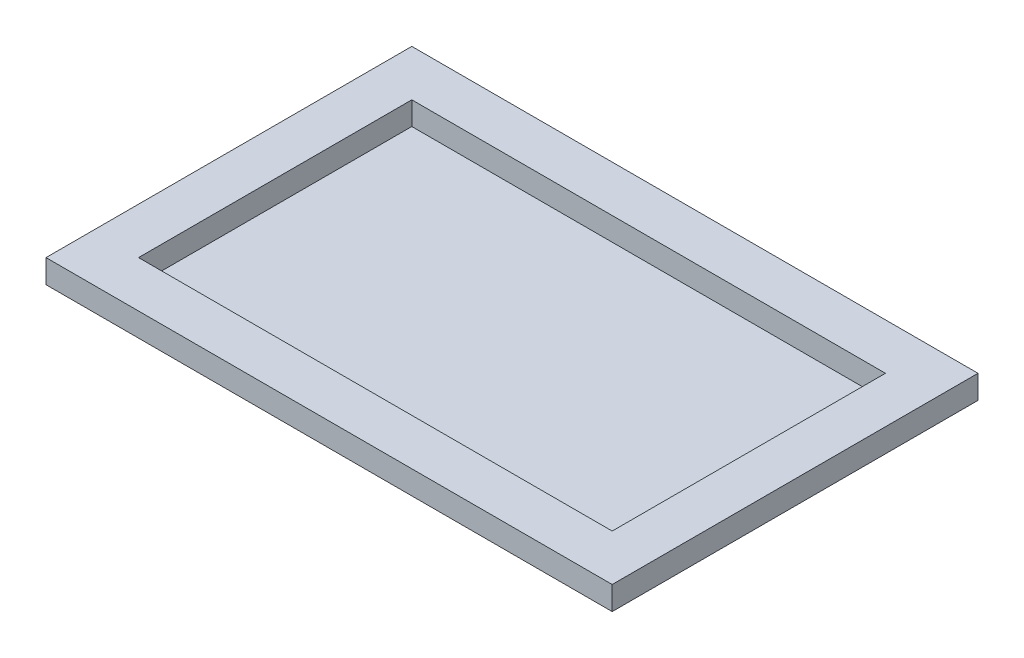
from build123d import *

# Parameters (mm, degrees)
CROQUIS1_W              = 310.8
CROQUIS1_H              = 200.8
CROQUIS1_W_2            = 260
CROQUIS1_H_2            = 150
SALIENTE_EXTRUIR1_DEPTH = 12.7
CROQUIS2_W              = 310.8
CROQUIS2_H              = 200.8
SALIENTE_EXTRUIR2_DEPTH = 0.2


with BuildPart() as part:
    # Croquis1 → Saliente-Extruir1 (new body)
    with BuildSketch(Plane(origin=(0, 0, 0), x_dir=(1, 0, 0), z_dir=(0, 1, 0))):
        Rectangle(CROQUIS1_W, CROQUIS1_H)
        Rectangle(CROQUIS1_W_2, CROQUIS1_H_2, mode=Mode.SUBTRACT)
    extrude(amount=SALIENTE_EXTRUIR1_DEPTH)

    # Croquis2 → Saliente-Extruir2 (add)
    with BuildSketch(Plane.XZ):
        Rectangle(CROQUIS2_W, CROQUIS2_H)
    extrude(amount=SALIENTE_EXTRUIR2_DEPTH)


solid = part.part
